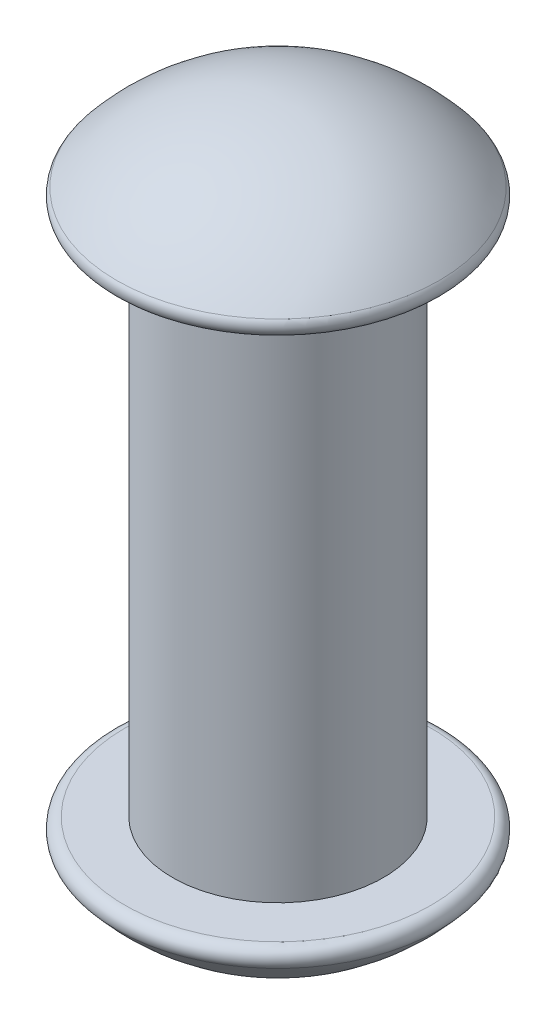
from build123d import *

# Parameters (mm, degrees)
FILLET1_R = 0.2


with BuildPart() as part:
    # Sketch1 → Revolve1 (revolve)
    with BuildSketch(Plane.XY):
        with BuildLine():
            Line((0, 0), (2, 0))
            Line((2, 0), (2, 5))
            Line((2, 5), (3.307189139, 5))
            ThreePointArc((3.307189139, 5), (1.870828693, 6.285533906), (0, 6.75))
            Line((0, 6.75), (0, 0))
        make_face()
    revolve1 = revolve(axis=Axis((0, 6.75, 0), (0, -1, 0)))

    # Mirror1: Revolve1 across plane
    add(revolve1.mirror(Plane.ZX))

    # Fillet1
    fillet1_edges = [part.edges().sort_by_distance(p)[0] for p in [
        (-3.307189139, -5, 0),
        (-3.307189139, 5, 0),
    ]]
    fillet(fillet1_edges, radius=FILLET1_R)


solid = part.part
